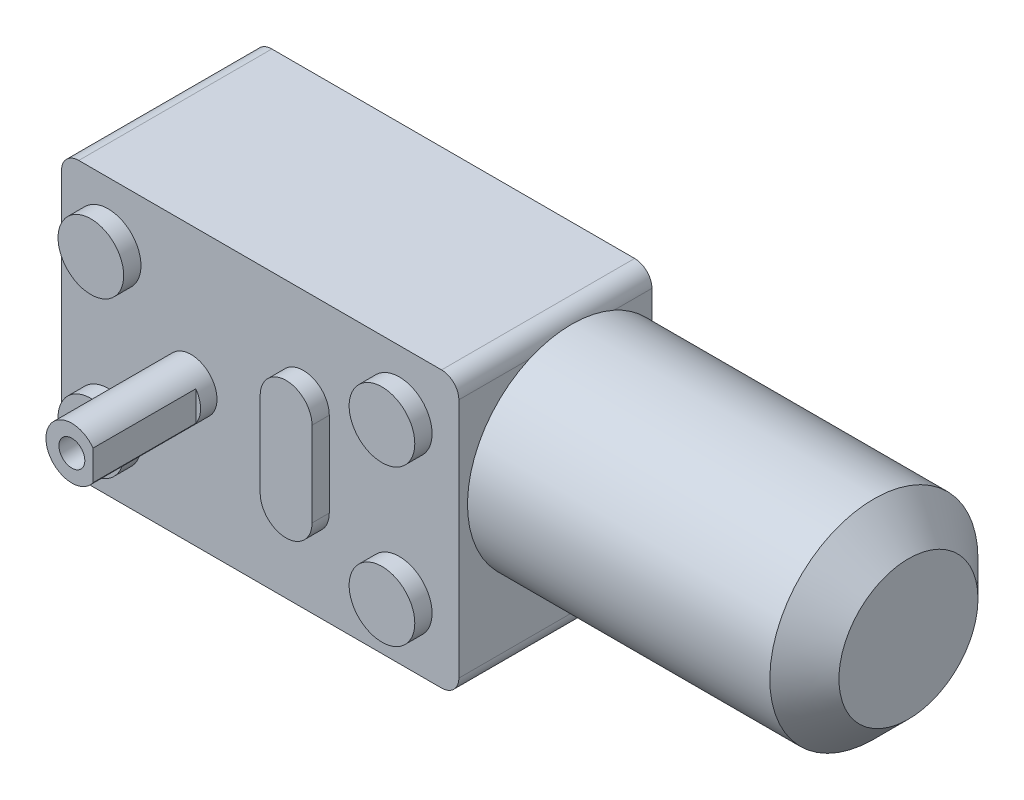
from build123d import *

# Parameters (mm, degrees)
SKETCH1_R             = 3
SKETCH1_R_2           = 1.5
BOSS_EXTRUDE1_DEPTH   = 13.8
CUT_EXTRUDE1_REACH    = 18.337
CUT_EXTRUDE1_START    = 1.9
BOSS_EXTRUDE2_DEPTH   = 2
SKETCH1_5_R           = 3.8
BOSS_EXTRUDE2_2_DEPTH = 2
BOSS_EXTRUDE2_3_DEPTH = 2
BOSS_EXTRUDE2_4_DEPTH = 2
BOSS_EXTRUDE2_5_DEPTH = 2
BOSS_EXTRUDE3_DEPTH   = 22.35
SKETCH2_R             = 12.05
BOSS_EXTRUDE4_DEPTH   = 39
CHAMFER1_SIZE         = 4


with BuildPart() as part:
    # Sketch1 → Boss-Extrude1 (new body)
    with BuildSketch(Plane(origin=(0, 0, 0), x_dir=(0, 1, 0), z_dir=(0, 0, 1))):
        Circle(SKETCH1_R)
        Circle(SKETCH1_R_2, mode=Mode.SUBTRACT)
    extrude(amount=BOSS_EXTRUDE1_DEPTH)

    # Sketch1<4> → Cut-Extrude1 (cut, up to next)
    with BuildSketch(Plane(origin=(0, 0, 0), x_dir=(0, 1, 0), z_dir=(0, 0, 1)).offset(CUT_EXTRUDE1_START), mode=Mode.PRIVATE) as cut_extrude1_sk1:
        with BuildLine():
            Line((1.731328969, -2.45), (-1.731328969, -2.45))
            ThreePointArc((-1.731328969, -2.45), (0, -3), (1.731328969, -2.45))
        make_face()
    cut_extrude1_tool1 = extrude(cut_extrude1_sk1.sketch, amount=CUT_EXTRUDE1_REACH, mode=Mode.PRIVATE) & part.part
    add(cut_extrude1_tool1.solids().sort_by_distance((2.671826, 0, 1.9))[0], mode=Mode.SUBTRACT)


with BuildPart() as body_2:
    # Sketch1<5> → Boss-Extrude2 (new body)
    with BuildSketch(Plane(origin=(0, 0, 0), x_dir=(0, 1, 0), z_dir=(0, 0, 1))):
        with BuildLine():
            Line((4.9, -10), (-4.9, -10))
            ThreePointArc((-4.9, -10), (-7.9, -13), (-4.9, -16))
            Line((-4.9, -16), (4.9, -16))
            ThreePointArc((4.9, -16), (7.9, -13), (4.9, -10))
        make_face()
    extrude(amount=BOSS_EXTRUDE2_DEPTH)


with BuildPart() as body_3:
    # Sketch1<5> → Boss-Extrude2 2 (new body)
    with BuildSketch(Plane(origin=(0, 0, 0), x_dir=(0, 1, 0), z_dir=(0, 0, 1))):
        with Locations((-9, 9.6)):
            Circle(SKETCH1_5_R)
    extrude(amount=BOSS_EXTRUDE2_2_DEPTH)


with BuildPart() as body_4:
    # Sketch1<5> → Boss-Extrude2 3 (new body)
    with BuildSketch(Plane(origin=(0, 0, 0), x_dir=(0, 1, 0), z_dir=(0, 0, 1))):
        with Locations((9, 9.6)):
            Circle(SKETCH1_5_R)
    extrude(amount=BOSS_EXTRUDE2_3_DEPTH)


with BuildPart() as body_5:
    # Sketch1<5> → Boss-Extrude2 4 (new body)
    with BuildSketch(Plane(origin=(0, 0, 0), x_dir=(0, 1, 0), z_dir=(0, 0, 1))):
        with Locations((-9, -24.1)):
            Circle(SKETCH1_5_R)
    extrude(amount=BOSS_EXTRUDE2_4_DEPTH)


with BuildPart() as body_6:
    # Sketch1<5> → Boss-Extrude2 5 (new body)
    with BuildSketch(Plane(origin=(0, 0, 0), x_dir=(0, 1, 0), z_dir=(0, 0, 1))):
        with Locations((9, -24.1)):
            Circle(SKETCH1_5_R)
    extrude(amount=BOSS_EXTRUDE2_5_DEPTH)


with BuildPart() as body_7:
    # Sketch1<6> → Boss-Extrude3 (new body)
    with BuildSketch(Plane(origin=(0, 0, 0), x_dir=(0, 1, 0), z_dir=(0, 0, 1))):
        with BuildLine():
            Line((13.95, 15), (-13.95, 15))
            ThreePointArc((-13.95, 15), (-15.364213562, 14.414213562), (-15.95, 13))
            Line((-15.95, 13), (-15.95, -29))
            ThreePointArc((-15.95, -29), (-15.364213562, -30.414213562), (-13.95, -31))
            Line((-13.95, -31), (13.95, -31))
            ThreePointArc((13.95, -31), (15.364213562, -30.414213562), (15.95, -29))
            Line((15.95, -29), (15.95, 13))
            ThreePointArc((15.95, 13), (15.364213562, 14.414213562), (13.95, 15))
        make_face()
    extrude(amount=-BOSS_EXTRUDE3_DEPTH)

    # Sketch2 → Boss-Extrude4 (add)
    with BuildSketch(Plane.YZ.offset(31)):
        with Locations((2.95, -13.05)):
            Circle(SKETCH2_R)
    extrude(amount=BOSS_EXTRUDE4_DEPTH)

    # Chamfer1
    chamfer1_edges = [body_7.edges().sort_by_distance(p)[0] for p in [
        (70, -9.1, -13.05),
    ]]
    chamfer(chamfer1_edges, length=CHAMFER1_SIZE)


solid = Compound([part.part, body_2.part, body_3.part, body_4.part, body_5.part, body_6.part, body_7.part])
